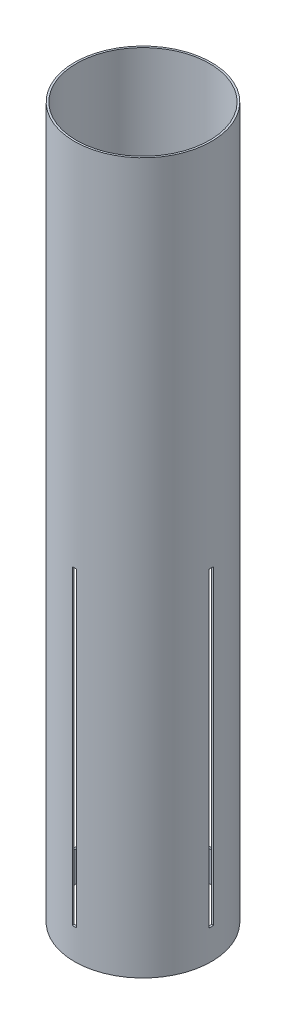
from build123d import *

# Parameters (mm, degrees)
SUSTAINER_TUBE_PROFILE_R   = 78.359
SUSTAINER_TUBE_PROFILE_R_2 = 76.2
SUSTAINER_TUBE_BODY_DEPTH  = 812.8
FIN_SLOT_CUT_REACH         = 833.471
FIN_SLOT_CUT_END_RADIUS    = 76.2
FIN_SLOT_PROFILE_W         = 2.54
FIN_SLOT_PROFILE_H         = 355.6
FIN_SLOT_PATTERN_COUNT     = 4


with BuildPart() as part:
    # Sustainer Tube Profile → Sustainer Tube Body (new body)
    with BuildSketch(Plane(origin=(0, 0, 0), x_dir=(1, 0, 0), z_dir=(0, 1, 0))):
        with Locations(Location((0, 0, 0), (0, 0, 270))):
            Circle(SUSTAINER_TUBE_PROFILE_R)
        with Locations(Location((0, 0, 0), (0, 0, 270))):
            Circle(SUSTAINER_TUBE_PROFILE_R_2, mode=Mode.SUBTRACT)
    extrude(amount=SUSTAINER_TUBE_BODY_DEPTH)

    # Fin Slot Cut: up to this cylinder (the profile starts outside it)
    fin_slot_cut_end = Plane(origin=(0, 212.471, 0), z_dir=(0, -1, 0)) * Cylinder(FIN_SLOT_CUT_END_RADIUS, 1820.342, mode=Mode.PRIVATE)
    # Fin Slot Profile → Fin Slot Cut (cut, up to the surface)
    with BuildSketch(Plane.XY.offset(78.359), mode=Mode.PRIVATE) as fin_slot_cut_sk1:
        with Locations((1.27, 212.471)):
            Rectangle(FIN_SLOT_PROFILE_W, FIN_SLOT_PROFILE_H)
    fin_slot_cut_tool1 = extrude(fin_slot_cut_sk1.sketch, amount=-FIN_SLOT_CUT_REACH, mode=Mode.PRIVATE) - fin_slot_cut_end
    # Fin Slot Profile → Fin Slot Cut (cut, up to the surface)
    with BuildSketch(Plane.XY.offset(78.359), mode=Mode.PRIVATE) as fin_slot_cut_sk2:
        with Locations((-1.27, 212.471)):
            Rectangle(FIN_SLOT_PROFILE_W, FIN_SLOT_PROFILE_H)
    fin_slot_cut_tool2 = extrude(fin_slot_cut_sk2.sketch, amount=-FIN_SLOT_CUT_REACH, mode=Mode.PRIVATE) - fin_slot_cut_end
    fin_slot_cut = fin_slot_cut_tool1.solids().sort_by_distance((1.27, 212.471, 78.359))[0] + fin_slot_cut_tool2.solids().sort_by_distance((-1.27, 212.471, 78.359))[0]
    add(fin_slot_cut, mode=Mode.SUBTRACT)

    # Fin Slot Pattern: Fin Slot Cut ×4 about axis
    fin_slot_pattern_axis = Axis((0, 0, 0), (0, 1, 0))
    for i in range(1, FIN_SLOT_PATTERN_COUNT):
        add(fin_slot_cut.rotate(fin_slot_pattern_axis, i * 360 / FIN_SLOT_PATTERN_COUNT), mode=Mode.SUBTRACT)


solid = part.part
